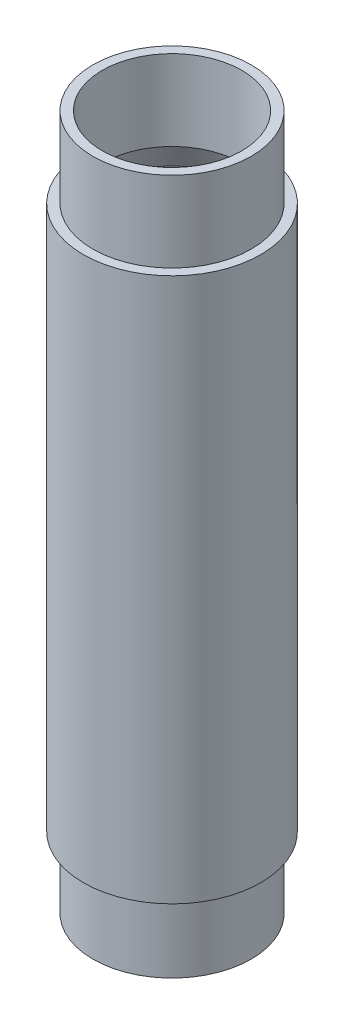
from build123d import *

# Parameters (mm, degrees)
SKETCH1_R                = 37.5
SKETCH1_R_2              = 33.5
BOSS_EXTRUDE1_DEPTH      = 230
BOSS_EXTRUDE2_DEPTH      = 30
BOSS_EXTRUDE2_DEPTH_BACK = 4
SKETCH2_R                = 33.5
SKETCH2_R_2              = 29.5
BOSS_EXTRUDE3_START      = -264
SKETCH2_2_R              = 33.5
SKETCH2_2_R_2            = 29.5
BOSS_EXTRUDE3_DEPTH      = 34


with BuildPart() as part:
    # Sketch1 → Boss-Extrude1 (new body)
    with BuildSketch(Plane(origin=(0, 0, 0), x_dir=(1, 0, 0), z_dir=(0, 1, 0))):
        Circle(SKETCH1_R)
        Circle(SKETCH1_R_2, mode=Mode.SUBTRACT)
    extrude(amount=BOSS_EXTRUDE1_DEPTH)

    # Sketch2 → Boss-Extrude2 (add, two sides: drawn at the far end of the back side and taken through both)
    with BuildSketch(Plane.XZ.offset(-BOSS_EXTRUDE2_DEPTH_BACK)):
        Circle(SKETCH2_R)
        Circle(SKETCH2_R_2, mode=Mode.SUBTRACT)
    extrude(amount=BOSS_EXTRUDE2_DEPTH + BOSS_EXTRUDE2_DEPTH_BACK)

    # Sketch3 → Revolve2 (revolve)
    with BuildSketch(Plane(origin=(0, 0, 0), x_dir=(0, 0, -1), z_dir=(1, 0, 0))):
        Polygon((-33.5, 220), (-29.5, 230), (-33.5, 230), align=None)
        Polygon((-29.5, 4), (-33.5, 14), (-33.5, 4), align=None)
    revolve(axis=Axis((0, 147.317017351, 0), (0, -1, 0)))


with BuildPart() as body_2:
    # Sketch2<2> → Boss-Extrude3 (new body)
    with BuildSketch(Plane.XZ.offset(BOSS_EXTRUDE3_START)):
        Circle(SKETCH2_2_R)
        Circle(SKETCH2_2_R_2, mode=Mode.SUBTRACT)
    extrude(amount=BOSS_EXTRUDE3_DEPTH)


solid = Compound([part.part, body_2.part])
